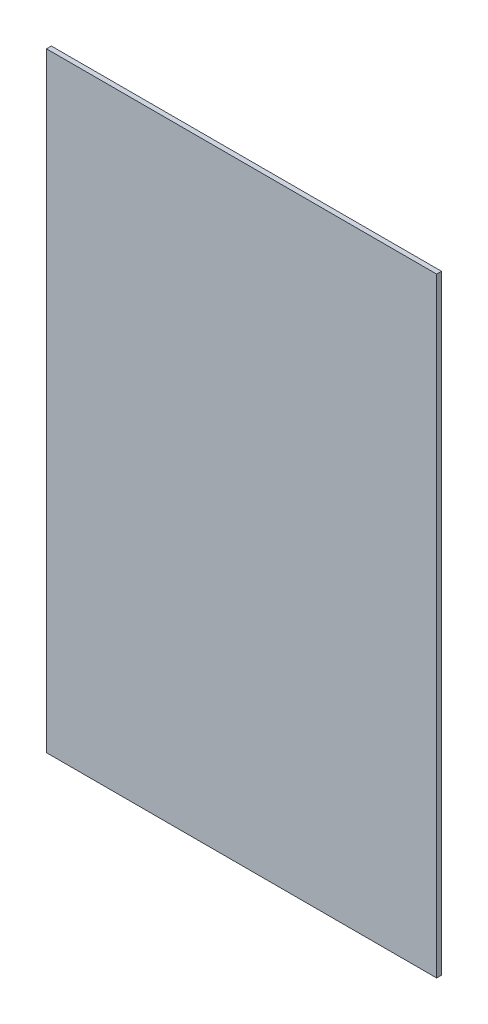
from build123d import *

# Parameters (mm, degrees)
SKETCH_1_W      = 80
SKETCH_1_H      = 125
EXTRUDE_1_DEPTH = 1


with BuildPart() as part:
    # 草图1 → 凸台-拉伸1 (new body)
    with BuildSketch(Plane.XY):
        with Locations((17.07651715, 25.935356201)):
            Rectangle(SKETCH_1_W, SKETCH_1_H)
    extrude(amount=EXTRUDE_1_DEPTH)


solid = part.part
